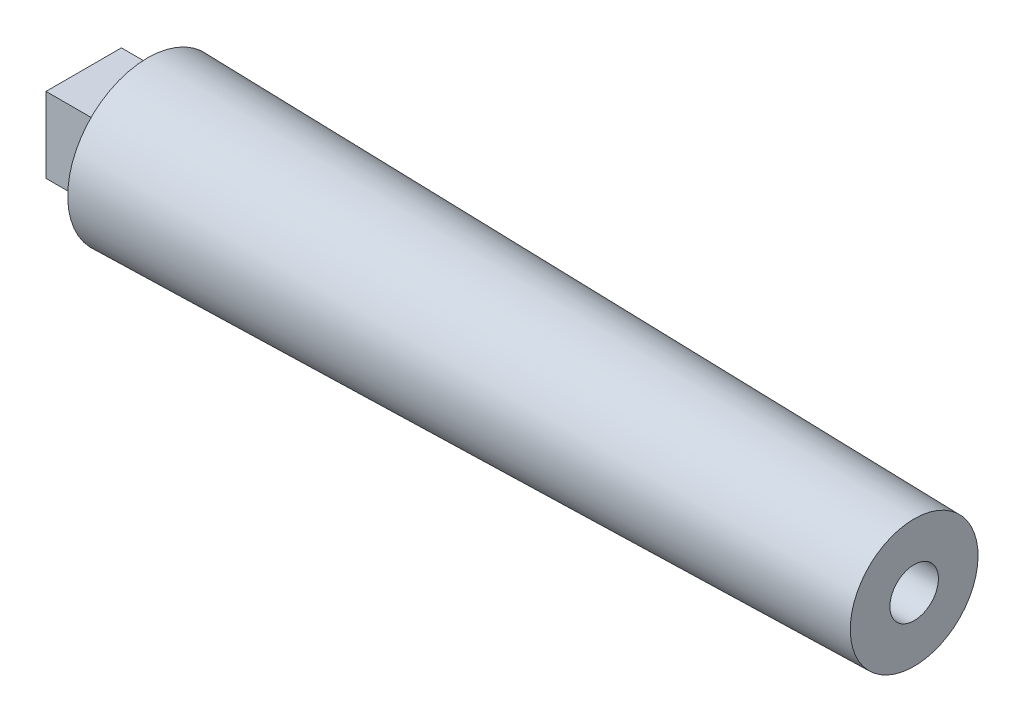
from build123d import *

# Parameters (mm, degrees)
SKETCH2_W           = 14.986
SKETCH2_H           = 14.986
BOSS_EXTRUDE1_DEPTH = 12.7
SKETCH3_R           = 4.826
CUT_EXTRUDE1_DEPTH  = 25.4


with BuildPart() as part:
    # Sketch1 → Revolve1 (revolve)
    with BuildSketch(Plane.XY):
        Polygon((0, 12.7), (0, 0), (-152.4, 0), (-152.4, 15.875), align=None)
    revolve(axis=Axis((0, 0, 0), (-1, 0, 0)))

    # Sketch2 → Boss-Extrude1 (add)
    with BuildSketch(Plane.ZY.offset(152.4)):
        Rectangle(SKETCH2_W, SKETCH2_H)
    extrude(amount=BOSS_EXTRUDE1_DEPTH)

    # Sketch3 → Cut-Extrude1 (cut)
    with BuildSketch(Plane(origin=(0, 0, 0), x_dir=(0, 0, -1), z_dir=(1, 0, 0))):
        with Locations(Location((0, 0, 0), (0, 0, 90))):
            Circle(SKETCH3_R)
    extrude(amount=-CUT_EXTRUDE1_DEPTH, mode=Mode.SUBTRACT)


solid = part.part
